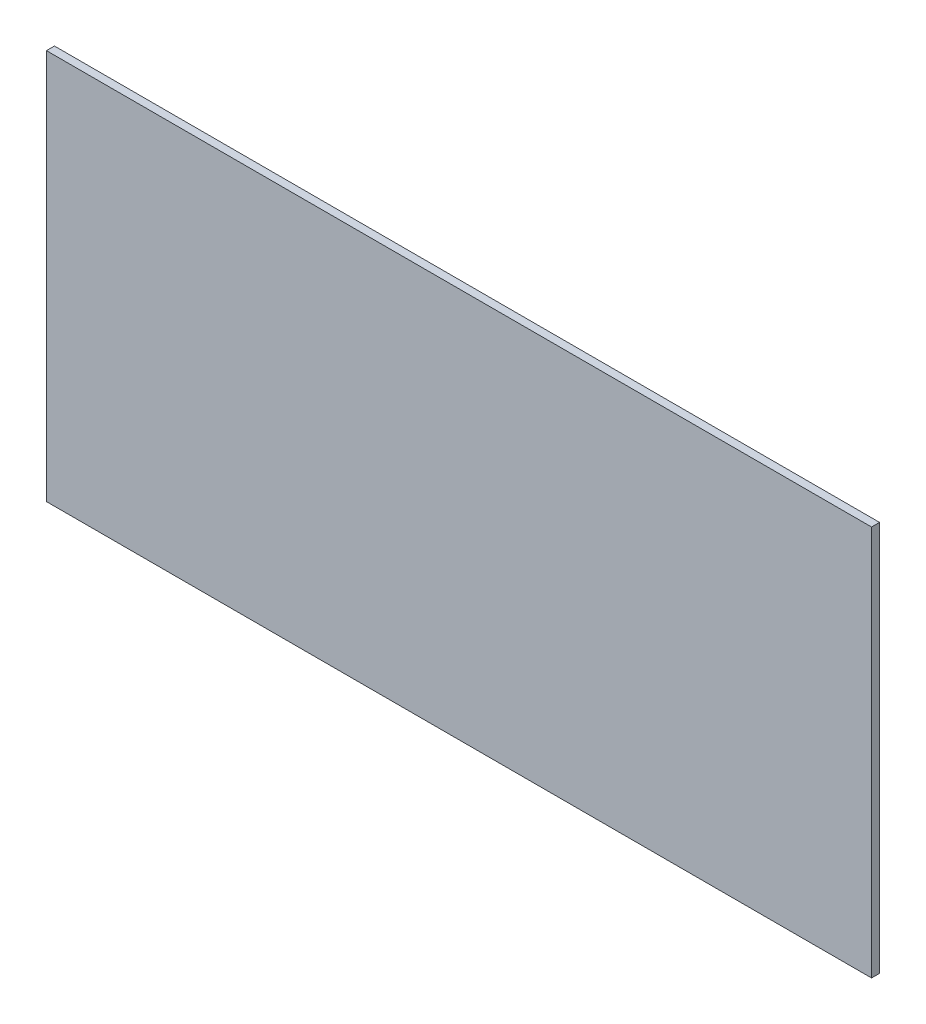
from build123d import *

# Parameters (mm, degrees)
SKETCH1_W           = 165
SKETCH1_H           = 78.10249676
BOSS_EXTRUDE1_DEPTH = 1.6


with BuildPart() as part:
    # Sketch1 → Boss-Extrude1 (new body)
    with BuildSketch(Plane.XY):
        with Locations((72.733997801, -8.940893594)):
            Rectangle(SKETCH1_W, SKETCH1_H)
    extrude(amount=BOSS_EXTRUDE1_DEPTH)


solid = part.part
